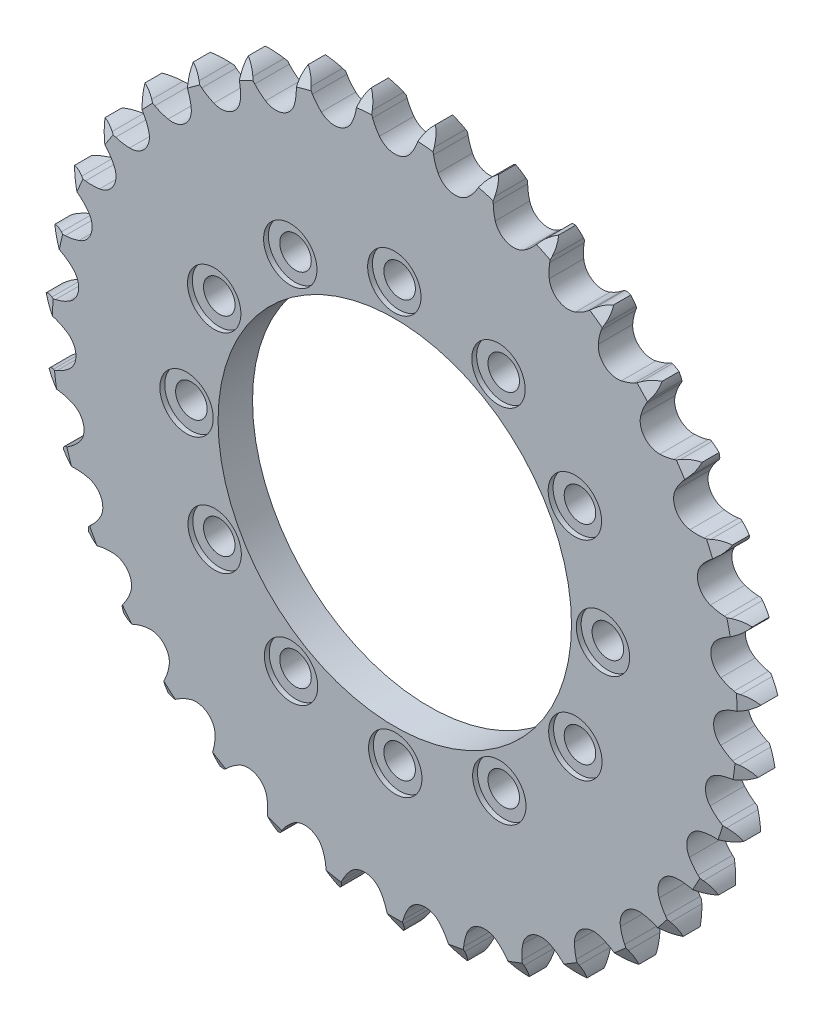
from build123d import *

# Parameters (mm, degrees)
EXTRUSION_DEPTH         = 7.2136
CIRPATTERN1_COUNT       = 12
CUT_EXTRUDE1_DEPTH      = 107.101930402
CUT_EXTRUDE1_DEPTH_BACK = 107.101930402
SKETCH8_R               = 37
CUT_EXTRUDE2_START      = 7.2136
SKETCH10_R              = 5.588
CUT_EXTRUDE2_DEPTH      = 1.016
CIRPATTERN2_COUNT       = 12


with BuildPart() as part:
    # Teeth Sketch → Extrusion (new body)
    with BuildSketch(Plane.XY):
        with BuildLine():
            ThreePointArc((6.71304247, 74.58801073), (5.721364967, 73.433815654), (5.028178681, 72.079163184))
            Line((5.028178681, 72.079163184), (4.640959349, 71.033174889))
            ThreePointArc((4.640959349, 71.033174889), (4.020032266, 69.686911282), (3.213588317, 68.442875791))
            ThreePointArc((3.213588317, 68.442875791), (0, 66.830622976), (-3.213588317, 68.442875791))
            ThreePointArc((-3.213588317, 68.442875791), (-4.020032266, 69.686911282), (-4.640959349, 71.033174889))
            Line((-4.640959349, 71.033174889), (-5.028178681, 72.079163184))
            ThreePointArc((-5.028178681, 72.079163184), (-5.721364967, 73.433815654), (-6.71304247, 74.58801073))
            ThreePointArc((-6.71304247, 74.58801073), (-7.482693818, 73.275293188), (-7.922857777, 71.81863735))
            Line((-7.922857777, 71.81863735), (-8.117085913, 70.720317836))
            ThreePointArc((-8.117085913, 70.720317836), (-8.487649793, 69.284818426), (-9.059002741, 67.91677897))
            ThreePointArc((-9.059002741, 67.91677897), (-11.933068516, 65.75662737), (-15.382892003, 66.769162268))
            ThreePointArc((-15.382892003, 66.769162268), (-16.39850718, 67.84920947), (-17.249840359, 69.062967255))
            Line((-17.249840359, 69.062967255), (-17.817605339, 70.023005406))
            ThreePointArc((-17.817605339, 70.023005406), (-18.741534375, 71.232114863), (-19.923364701, 72.190690694))
            ThreePointArc((-19.923364701, 72.190690694), (-20.446252667, 70.761642508), (-20.619247067, 69.249801418))
            Line((-20.619247067, 69.249801418), (-20.614241355, 68.134451579))
            ThreePointArc((-20.614241355, 68.134451579), (-20.722531804, 66.655854499), (-21.040429998, 65.207780992))
            ThreePointArc((-21.040429998, 65.207780992), (-23.482598391, 62.569159656), (-27.057776883, 62.949432932))
            ThreePointArc((-27.057776883, 62.949432932), (-28.249920581, 63.830778239), (-29.304297307, 64.873019029))
            Line((-29.304297307, 64.873019029), (-30.034359501, 65.716250619))
            ThreePointArc((-30.034359501, 65.716250619), (-31.159335447, 66.740955291), (-32.493333597, 67.473102461))
            ThreePointArc((-32.493333597, 67.473102461), (-32.752652133, 65.973654415), (-32.65291679, 64.455219891))
            Line((-32.65291679, 64.455219891), (-32.448838118, 63.358687986))
            ThreePointArc((-32.448838118, 63.358687986), (-32.291374592, 61.884516564), (-32.345600523, 60.402951279))
            ThreePointArc((-32.345600523, 60.402951279), (-34.277378233, 57.370667669), (-37.863002551, 57.106457027))
            ThreePointArc((-37.863002551, 57.106457027), (-39.19335829, 57.760773275), (-40.416890027, 58.597998593))
            Line((-40.416890027, 58.597998593), (-41.285784636, 59.297321467))
            ThreePointArc((-41.285784636, 59.297321467), (-42.57564984, 60.104686501), (-44.018940016, 60.586873197))
            ThreePointArc((-44.018940016, 60.586873197), (-44.006354409, 59.065218786), (-43.637094901, 57.588994562))
            Line((-43.637094901, 57.588994562), (-43.240502525, 56.54652403))
            ThreePointArc((-43.240502525, 56.54652403), (-42.822346032, 55.124159347), (-42.611156832, 53.656721012))
            ThreePointArc((-42.611156832, 53.656721012), (-43.970454934, 50.328235218), (-47.451280163, 49.428032606))
            ThreePointArc((-47.451280163, 49.428032606), (-48.877089215, 49.834289533), (-50.230450647, 50.439590267))
            Line((-50.230450647, 50.439590267), (-51.210250682, 50.972527612))
            ThreePointArc((-51.210250682, 50.972527612), (-52.623547816, 51.536603632), (-54.129741484, 51.753331977))
            ThreePointArc((-54.129741484, 51.753331977), (-53.845656247, 50.258378426), (-53.218740877, 48.871811564))
            Line((-53.218740877, 48.871811564), (-52.642381603, 47.916908265))
            ThreePointArc((-52.642381603, 47.916908265), (-51.976972035, 46.592066293), (-51.507155501, 45.185919584))
            ThreePointArc((-51.507155501, 45.185919584), (-52.250285035, 41.668211877), (-55.514434587, 40.160950547))
            ThreePointArc((-55.514434587, 40.160950547), (-56.989870277, 40.306090721), (-58.429563253, 40.660012009))
            Line((-58.429563253, 40.660012009), (-59.488777136, 41.009434779))
            ThreePointArc((-59.488777136, 41.009434779), (-60.980081666, 41.312091918), (-62.500768523, 41.256396085))
            ThreePointArc((-62.500768523, 41.256396085), (-61.954314388, 39.83619243), (-61.089892733, 38.58384833))
            Line((-61.089892733, 38.58384833), (-60.352291222, 37.747203643))
            ThreePointArc((-60.352291222, 37.747203643), (-59.461015391, 36.562465892), (-58.747671811, 35.26280552))
            ThreePointArc((-58.747671811, 35.26280552), (-58.850747983, 31.668937922), (-61.793309406, 29.603062493))
            ThreePointArc((-61.793309406, 29.603062493), (-63.270950016, 29.48242099), (-64.750701621, 29.573587509))
            Line((-64.750701621, 29.573587509), (-65.855285346, 29.72826497))
            ThreePointArc((-65.855285346, 29.72826497), (-67.376665517, 29.759775578), (-68.862969436, 29.433445677))
            ThreePointArc((-68.862969436, 29.433445677), (-68.071709889, 28.133638433), (-66.997565172, 27.055768464))
            Line((-66.997565172, 27.055768464), (-66.122428543, 26.364272836))
            ThreePointArc((-66.122428543, 26.364272836), (-65.033932787, 25.357717754), (-64.099989612, 24.206315873))
            ThreePointArc((-64.099989612, 24.206315873), (-63.559699469, 20.651798244), (-66.086096418, 18.093707653))
            ThreePointArc((-66.086096418, 18.093707653), (-67.518449363, 17.71116199), (-68.990699161, 17.536643574))
            Line((-68.990699161, 17.536643574), (-70.105150498, 17.491604264))
            ThreePointArc((-70.105150498, 17.491604264), (-71.6077079, 17.250955565), (-73.01185785, 16.664480107))
            ThreePointArc((-73.01185785, 16.664480107), (-72.001224624, 15.526846148), (-70.75188074, 14.658093938))
            Line((-70.75188074, 14.658093938), (-69.767336604, 14.133972608))
            ThreePointArc((-69.767336604, 14.133972608), (-68.516606073, 13.337951702), (-67.392081005, 12.371815317))
            ThreePointArc((-67.392081005, 12.371815317), (-66.225789916, 8.970892779), (-68.254821914, 6.002806162))
            ThreePointArc((-68.254821914, 6.002806162), (-69.595850193, 5.37065167), (-71.013278864, 4.936057485))
            Line((-71.013278864, 4.936057485), (-72.101778431, 4.692749005))
            ThreePointArc((-72.101778431, 4.692749005), (-73.537219633, 4.187675646), (-74.814085078, 3.359904435))
            ThreePointArc((-74.814085078, 3.359904435), (-73.616560757, 2.421008252), (-72.232172646, 1.789296212))
            Line((-72.232172646, 1.789296212), (-71.169865063, 1.449394871))
            ThreePointArc((-71.169865063, 1.449394871), (-69.797099265, 0.889492908), (-68.518135464, 0.139674437))
            ThreePointArc((-68.518135464, 0.139674437), (-66.763328985, -2.998344562), (-68.229781274, -6.281030459))
            ThreePointArc((-68.229781274, -6.281030459), (-69.436383134, -7.142475813), (-70.753433355, -7.823177553))
            Line((-70.753433355, -7.823177553), (-71.780995879, -8.256935068))
            ThreePointArc((-71.780995879, -8.256935068), (-73.10318462, -9.010199614), (-74.211726055, -10.05266133))
            ThreePointArc((-74.211726055, -10.05266133), (-72.865800055, -10.762642841), (-71.390863091, -11.137010967))
            Line((-71.390863091, -11.137010967), (-70.284935499, -11.281767609))
            ThreePointArc((-70.284935499, -11.281767609), (-68.834256257, -11.587554919), (-67.441960672, -12.096955695))
            ThreePointArc((-67.441960672, -12.096955695), (-65.155039727, -14.871212641), (-66.011779325, -18.362989592))
            ThreePointArc((-66.011779325, -18.362989592), (-67.045173588, -19.426038247), (-68.219514282, -20.330969227))
            Line((-68.219514282, -20.330969227), (-69.153113058, -20.941234454))
            ThreePointArc((-69.153113058, -20.941234454), (-70.319553103, -21.918479645), (-71.224141095, -23.142126289))
            ThreePointArc((-71.224141095, -23.142126289), (-69.773072586, -23.600373738), (-68.254992455, -23.705365449))
            Line((-68.254992455, -23.705365449), (-67.140990279, -23.650324796))
            ThreePointArc((-67.140990279, -23.650324796), (-65.659023615, -23.692169198), (-64.198145773, -23.944779717))
            ThreePointArc((-64.198145773, -23.944779717), (-61.452613883, -26.26610771), (-61.672104473, -29.854747131))
            ThreePointArc((-61.672104473, -29.854747131), (-62.499076998, -31.085231827), (-63.492963888, -32.185306822))
            Line((-63.492963888, -32.185306822), (-64.302592284, -32.952465334))
            ThreePointArc((-64.302592284, -32.952465334), (-65.275793291, -34.122281706), (-65.947353637, -35.487784268))
            ThreePointArc((-65.947353637, -35.487784268), (-64.437781154, -35.679569204), (-62.925350201, -35.511809981))
            Line((-62.925350201, -35.511809981), (-61.839078386, -35.258741085))
            ThreePointArc((-61.839078386, -35.258741085), (-60.373455931, -35.035297664), (-58.890949646, -35.022998817))
            ThreePointArc((-58.890949646, -35.022998817), (-55.775050465, -36.816788466), (-55.350237439, -40.386948533))
            ThreePointArc((-55.350237439, -40.386948533), (-55.94420865, -41.74532048), (-56.725697393, -43.005182174))
            Line((-56.725697393, -43.005182174), (-57.385333286, -43.904576866))
            ThreePointArc((-57.385333286, -43.904576866), (-58.134015774, -45.229365557), (-58.550963971, -46.69283566))
            ThreePointArc((-58.550963971, -46.69283566), (-57.031406416, -46.611993959), (-55.573235417, -46.176875721))
            Line((-55.573235417, -46.176875721), (-54.549607633, -45.733912424))
            ThreePointArc((-54.549607633, -45.733912424), (-53.147435697, -45.252362836), (-51.690949942, -44.975549918))
            ThreePointArc((-51.690949942, -44.975549918), (-48.304831033, -46.184147347), (-47.249368232, -49.621080178))
            ThreePointArc((-47.249368232, -49.621080178), (-47.591247404, -51.063680184), (-48.13522031, -52.442835586))
            Line((-48.13522031, -52.442835586), (-48.623662459, -53.445559171))
            ThreePointArc((-48.623662459, -53.445559171), (-49.123763156, -54.882740383), (-49.272698147, -56.397140896))
            ThreePointArc((-49.272698147, -56.397140896), (-47.79199535, -56.046270876), (-46.434951121, -55.357778681))
            Line((-46.434951121, -55.357778681), (-45.506867607, -54.739158188))
            ThreePointArc((-45.506867607, -54.739158188), (-44.21321315, -54.014979833), (-42.829560576, -53.482549839))
            ThreePointArc((-42.829560576, -53.482549839), (-39.282054587, -54.067109732), (-37.629865453, -57.260349478))
            ThreePointArc((-37.629865453, -57.260349478), (-37.708664308, -58.740811192), (-37.99763764, -60.194933112))
            Line((-37.99763764, -60.194933112), (-38.299187113, -61.26875723))
            ThreePointArc((-38.299187113, -61.26875723), (-38.534632372, -62.772138777), (-38.410767263, -64.288795619))
            ThreePointArc((-38.410767263, -64.288795619), (-37.016510231, -63.679174531), (-35.804209288, -62.759437086))
            Line((-35.804209288, -62.759437086), (-35.001499413, -61.985042368))
            ThreePointArc((-35.001499413, -61.985042368), (-33.857941554, -61.041510934), (-32.591593892, -60.270576602))
            ThreePointArc((-32.591593892, -60.270576602), (-28.996720584, -60.212310724), (-26.800907836, -63.059224032))
            ThreePointArc((-26.800907836, -63.059224032), (-26.614093715, -64.529964196), (-26.638779631, -66.012315959))
            Line((-26.638779631, -66.012315959), (-26.743744381, -67.12272702))
            ThreePointArc((-26.743744381, -67.12272702), (-26.706966797, -68.643988981), (-26.314282715, -70.114155555))
            ThreePointArc((-26.314282715, -70.114155555), (-25.051284015, -69.265377122), (-24.02269071, -68.143955544))
            Line((-24.02269071, -68.143955544), (-23.371154229, -67.238676285))
            ThreePointArc((-23.371154229, -67.238676285), (-22.414447858, -66.106117649), (-21.306106564, -65.121457443))
            ThreePointArc((-21.306106564, -65.121457443), (-17.779408124, -64.422238506), (-15.110546989, -66.83132324))
            ThreePointArc((-15.110546989, -66.83132324), (-14.664124252, -68.245071055), (-14.423729327, -69.708008656))
            Line((-14.423729327, -69.708008656), (-14.328735699, -70.819317134))
            ThreePointArc((-14.328735699, -70.819317134), (-14.020917334, -72.309564898), (-13.372035469, -73.68598884))
            ThreePointArc((-13.372035469, -73.68598884), (-12.280888919, -72.6253335), (-11.469063086, -71.338271201))
            Line((-11.469063086, -71.338271201), (-10.989640918, -70.331203822))
            ThreePointArc((-10.989640918, -70.331203822), (-10.250535365, -69.04601935), (-9.335823441, -67.879281059))
            ThreePointArc((-9.335823441, -67.879281059), (-5.990650857, -66.561582535), (-2.93452073, -68.455408731))
            ThreePointArc((-2.93452073, -68.455408731), (-2.242837769, -69.766725179), (-1.745088495, -71.163228599))
            Line((-1.745088495, -71.163228599), (-1.453189662, -72.239716126))
            ThreePointArc((-1.453189662, -72.239716126), (-0.884224052, -73.651051903), (0, -74.889493815))
            ThreePointArc((0, -74.889493815), (0.884224052, -73.651051903), (1.453189662, -72.239716126))
            Line((1.453189662, -72.239716126), (1.745088495, -71.163228599))
            ThreePointArc((1.745088495, -71.163228599), (2.242837769, -69.766725179), (2.93452073, -68.455408731))
            ThreePointArc((2.93452073, -68.455408731), (5.990650857, -66.561582535), (9.335823441, -67.879281059))
            ThreePointArc((9.335823441, -67.879281059), (10.250535365, -69.04601935), (10.989640918, -70.331203822))
            Line((10.989640918, -70.331203822), (11.469063086, -71.338271201))
            ThreePointArc((11.469063086, -71.338271201), (12.280888919, -72.6253335), (13.372035469, -73.68598884))
            ThreePointArc((13.372035469, -73.68598884), (14.020917334, -72.309564898), (14.328735699, -70.819317134))
            Line((14.328735699, -70.819317134), (14.423729327, -69.708008656))
            ThreePointArc((14.423729327, -69.708008656), (14.664124252, -68.245071055), (15.110546989, -66.83132324))
            ThreePointArc((15.110546989, -66.83132324), (17.779408124, -64.422238506), (21.306106564, -65.121457443))
            ThreePointArc((21.306106564, -65.121457443), (22.414447858, -66.106117649), (23.371154229, -67.238676285))
            Line((23.371154229, -67.238676285), (24.02269071, -68.143955544))
            ThreePointArc((24.02269071, -68.143955544), (25.051284015, -69.265377122), (26.314282715, -70.114155555))
            ThreePointArc((26.314282715, -70.114155555), (26.706966797, -68.643988981), (26.743744381, -67.12272702))
            Line((26.743744381, -67.12272702), (26.638779631, -66.012315959))
            ThreePointArc((26.638779631, -66.012315959), (26.614093715, -64.529964196), (26.800907836, -63.059224032))
            ThreePointArc((26.800907836, -63.059224032), (28.996720584, -60.212310724), (32.591593892, -60.270576602))
            ThreePointArc((32.591593892, -60.270576602), (33.857941554, -61.041510934), (35.001499413, -61.985042368))
            Line((35.001499413, -61.985042368), (35.804209288, -62.759437086))
            ThreePointArc((35.804209288, -62.759437086), (37.016510231, -63.679174531), (38.410767263, -64.288795619))
            ThreePointArc((38.410767263, -64.288795619), (38.534632372, -62.772138777), (38.299187113, -61.26875723))
            Line((38.299187113, -61.26875723), (37.99763764, -60.194933112))
            ThreePointArc((37.99763764, -60.194933112), (37.708664308, -58.740811192), (37.629865453, -57.260349478))
            ThreePointArc((37.629865453, -57.260349478), (39.282054587, -54.067109732), (42.829560576, -53.482549839))
            ThreePointArc((42.829560576, -53.482549839), (44.21321315, -54.014979833), (45.506867607, -54.739158188))
            Line((45.506867607, -54.739158188), (46.434951121, -55.357778681))
            ThreePointArc((46.434951121, -55.357778681), (47.79199535, -56.046270876), (49.272698147, -56.397140896))
            ThreePointArc((49.272698147, -56.397140896), (49.123763156, -54.882740383), (48.623662459, -53.445559171))
            Line((48.623662459, -53.445559171), (48.13522031, -52.442835586))
            ThreePointArc((48.13522031, -52.442835586), (47.591247404, -51.063680184), (47.249368232, -49.621080178))
            ThreePointArc((47.249368232, -49.621080178), (48.304831033, -46.184147347), (51.690949942, -44.975549918))
            ThreePointArc((51.690949942, -44.975549918), (53.147435697, -45.252362836), (54.549607633, -45.733912424))
            Line((54.549607633, -45.733912424), (55.573235417, -46.176875721))
            ThreePointArc((55.573235417, -46.176875721), (57.031406416, -46.611993959), (58.550963971, -46.69283566))
            ThreePointArc((58.550963971, -46.69283566), (58.134015774, -45.229365557), (57.385333286, -43.904576866))
            Line((57.385333286, -43.904576866), (56.725697393, -43.005182174))
            ThreePointArc((56.725697393, -43.005182174), (55.94420865, -41.74532048), (55.350237439, -40.386948533))
            ThreePointArc((55.350237439, -40.386948533), (55.775050465, -36.816788466), (58.890949646, -35.022998817))
            ThreePointArc((58.890949646, -35.022998817), (60.373455931, -35.035297664), (61.839078386, -35.258741085))
            Line((61.839078386, -35.258741085), (62.925350201, -35.511809981))
            ThreePointArc((62.925350201, -35.511809981), (64.437781154, -35.679569204), (65.947353637, -35.487784268))
            ThreePointArc((65.947353637, -35.487784268), (65.275793291, -34.122281706), (64.302592284, -32.952465334))
            Line((64.302592284, -32.952465334), (63.492963888, -32.185306822))
            ThreePointArc((63.492963888, -32.185306822), (62.499076998, -31.085231827), (61.672104473, -29.854747131))
            ThreePointArc((61.672104473, -29.854747131), (61.452613883, -26.26610771), (64.198145773, -23.944779717))
            ThreePointArc((64.198145773, -23.944779717), (65.659023615, -23.692169198), (67.140990279, -23.650324796))
            Line((67.140990279, -23.650324796), (68.254992455, -23.705365449))
            ThreePointArc((68.254992455, -23.705365449), (69.773072586, -23.600373738), (71.224141095, -23.142126289))
            ThreePointArc((71.224141095, -23.142126289), (70.319553103, -21.918479645), (69.153113058, -20.941234454))
            Line((69.153113058, -20.941234454), (68.219514282, -20.330969227))
            ThreePointArc((68.219514282, -20.330969227), (67.045173588, -19.426038247), (66.011779325, -18.362989592))
            ThreePointArc((66.011779325, -18.362989592), (65.155039727, -14.871212641), (67.441960672, -12.096955695))
            ThreePointArc((67.441960672, -12.096955695), (68.834256257, -11.587554919), (70.284935499, -11.281767609))
            Line((70.284935499, -11.281767609), (71.390863091, -11.137010967))
            ThreePointArc((71.390863091, -11.137010967), (72.865800055, -10.762642841), (74.211726055, -10.05266133))
            ThreePointArc((74.211726055, -10.05266133), (73.10318462, -9.010199614), (71.780995879, -8.256935068))
            Line((71.780995879, -8.256935068), (70.753433355, -7.823177553))
            ThreePointArc((70.753433355, -7.823177553), (69.436383134, -7.142475813), (68.229781274, -6.281030459))
            ThreePointArc((68.229781274, -6.281030459), (66.763328985, -2.998344562), (68.518135464, 0.139674437))
            ThreePointArc((68.518135464, 0.139674437), (69.797099265, 0.889492908), (71.169865063, 1.449394871))
            Line((71.169865063, 1.449394871), (72.232172646, 1.789296212))
            ThreePointArc((72.232172646, 1.789296212), (73.616560757, 2.421008252), (74.814085078, 3.359904435))
            ThreePointArc((74.814085078, 3.359904435), (73.537219633, 4.187675646), (72.101778431, 4.692749005))
            Line((72.101778431, 4.692749005), (71.013278864, 4.936057485))
            ThreePointArc((71.013278864, 4.936057485), (69.595850193, 5.37065167), (68.254821914, 6.002806162))
            ThreePointArc((68.254821914, 6.002806162), (66.225789916, 8.970892779), (67.392081005, 12.371815317))
            ThreePointArc((67.392081005, 12.371815317), (68.516606073, 13.337951702), (69.767336604, 14.133972608))
            Line((69.767336604, 14.133972608), (70.75188074, 14.658093938))
            ThreePointArc((70.75188074, 14.658093938), (72.001224624, 15.526846148), (73.01185785, 16.664480107))
            ThreePointArc((73.01185785, 16.664480107), (71.6077079, 17.250955565), (70.105150498, 17.491604264))
            Line((70.105150498, 17.491604264), (68.990699161, 17.536643574))
            ThreePointArc((68.990699161, 17.536643574), (67.518449363, 17.71116199), (66.086096418, 18.093707653))
            ThreePointArc((66.086096418, 18.093707653), (63.559699469, 20.651798244), (64.099989612, 24.206315873))
            ThreePointArc((64.099989612, 24.206315873), (65.033932787, 25.357717754), (66.122428543, 26.364272836))
            Line((66.122428543, 26.364272836), (66.997565172, 27.055768464))
            ThreePointArc((66.997565172, 27.055768464), (68.071709889, 28.133638433), (68.862969436, 29.433445677))
            ThreePointArc((68.862969436, 29.433445677), (67.376665517, 29.759775578), (65.855285346, 29.72826497))
            Line((65.855285346, 29.72826497), (64.750701621, 29.573587509))
            ThreePointArc((64.750701621, 29.573587509), (63.270950016, 29.48242099), (61.793309406, 29.603062493))
            ThreePointArc((61.793309406, 29.603062493), (58.850747983, 31.668937922), (58.747671811, 35.26280552))
            ThreePointArc((58.747671811, 35.26280552), (59.461015391, 36.562465892), (60.352291222, 37.747203643))
            Line((60.352291222, 37.747203643), (61.089892733, 38.58384833))
            ThreePointArc((61.089892733, 38.58384833), (61.954314388, 39.83619243), (62.500768523, 41.256396085))
            ThreePointArc((62.500768523, 41.256396085), (60.980081666, 41.312091918), (59.488777136, 41.009434779))
            Line((59.488777136, 41.009434779), (58.429563253, 40.660012009))
            ThreePointArc((58.429563253, 40.660012009), (56.989870277, 40.306090721), (55.514434587, 40.160950547))
            ThreePointArc((55.514434587, 40.160950547), (52.250285035, 41.668211877), (51.507155501, 45.185919584))
            ThreePointArc((51.507155501, 45.185919584), (51.976972035, 46.592066293), (52.642381603, 47.916908265))
            Line((52.642381603, 47.916908265), (53.218740877, 48.871811564))
            ThreePointArc((53.218740877, 48.871811564), (53.845656247, 50.258378426), (54.129741484, 51.753331977))
            ThreePointArc((54.129741484, 51.753331977), (52.623547816, 51.536603632), (51.210250682, 50.972527612))
            Line((51.210250682, 50.972527612), (50.230450647, 50.439590267))
            ThreePointArc((50.230450647, 50.439590267), (48.877089215, 49.834289533), (47.451280163, 49.428032606))
            ThreePointArc((47.451280163, 49.428032606), (43.970454934, 50.328235218), (42.611156832, 53.656721012))
            ThreePointArc((42.611156832, 53.656721012), (42.822346032, 55.124159347), (43.240502525, 56.54652403))
            Line((43.240502525, 56.54652403), (43.637094901, 57.588994562))
            ThreePointArc((43.637094901, 57.588994562), (44.006354409, 59.065218786), (44.018940016, 60.586873197))
            ThreePointArc((44.018940016, 60.586873197), (42.57564984, 60.104686501), (41.285784636, 59.297321467))
            Line((41.285784636, 59.297321467), (40.416890027, 58.597998593))
            ThreePointArc((40.416890027, 58.597998593), (39.19335829, 57.760773275), (37.863002551, 57.106457027))
            ThreePointArc((37.863002551, 57.106457027), (34.277378233, 57.370667669), (32.345600523, 60.402951279))
            ThreePointArc((32.345600523, 60.402951279), (32.291374592, 61.884516564), (32.448838118, 63.358687986))
            Line((32.448838118, 63.358687986), (32.65291679, 64.455219891))
            ThreePointArc((32.65291679, 64.455219891), (32.752652133, 65.973654415), (32.493333597, 67.473102461))
            ThreePointArc((32.493333597, 67.473102461), (31.159335447, 66.740955291), (30.034359501, 65.716250619))
            Line((30.034359501, 65.716250619), (29.304297307, 64.873019029))
            ThreePointArc((29.304297307, 64.873019029), (28.249920581, 63.830778239), (27.057776883, 62.949432932))
            ThreePointArc((27.057776883, 62.949432932), (23.482598391, 62.569159656), (21.040429998, 65.207780992))
            ThreePointArc((21.040429998, 65.207780992), (20.722531804, 66.655854499), (20.614241355, 68.134451579))
            Line((20.614241355, 68.134451579), (20.619247067, 69.249801418))
            ThreePointArc((20.619247067, 69.249801418), (20.446252667, 70.761642508), (19.923364701, 72.190690694))
            ThreePointArc((19.923364701, 72.190690694), (18.741534375, 71.232114863), (17.817605339, 70.023005406))
            Line((17.817605339, 70.023005406), (17.249840359, 69.062967255))
            ThreePointArc((17.249840359, 69.062967255), (16.39850718, 67.84920947), (15.382892003, 66.769162268))
            ThreePointArc((15.382892003, 66.769162268), (11.933068516, 65.75662737), (9.059002741, 67.91677897))
            ThreePointArc((9.059002741, 67.91677897), (8.487649793, 69.284818426), (8.117085913, 70.720317836))
            Line((8.117085913, 70.720317836), (7.922857777, 71.81863735))
            ThreePointArc((7.922857777, 71.81863735), (7.482693818, 73.275293188), (6.71304247, 74.58801073))
        make_face()
    extrude(amount=EXTRUSION_DEPTH)

    # Sketch7 → M6 Clearance Hole1 (revolve, cut)
    with BuildSketch(Plane(origin=(0, 43.500000122, 0), x_dir=(0, 1, 0), z_dir=(1, 0, 0))):
        Polygon((0, 0), (0, 19.254840043), (3.3, 17.272), (3.3, 0), align=None)
    m6_clearance_hole1 = revolve(axis=Axis((0, 43.500000122, -6.35), (0, 0, 1)), mode=Mode.SUBTRACT)

    # CirPattern1: M6 Clearance Hole1 ×12 about axis
    cirpattern1_axis = Axis((0, -0.098226523, 0), (0, 0, 1))
    for i in range(1, CIRPATTERN1_COUNT):
        add(m6_clearance_hole1.rotate(cirpattern1_axis, i * 360 / CIRPATTERN1_COUNT), mode=Mode.SUBTRACT)

    # Sketch8 → Cut-Extrude1 (cut, two sides: drawn at the far end of the back side and taken through both)
    with BuildSketch(Plane(origin=(0, 0, 0), x_dir=(-1, 0, 0), z_dir=(0, 0, -1)).offset(-CUT_EXTRUDE1_DEPTH_BACK)):
        Circle(SKETCH8_R)
    extrude(amount=CUT_EXTRUDE1_DEPTH + CUT_EXTRUDE1_DEPTH_BACK, mode=Mode.SUBTRACT)

    # Sketch5 → Cut-Revolve1 (revolve, cut)
    with BuildSketch(Plane(origin=(0, 0, 0), x_dir=(0, 0, -1), z_dir=(1, 0, 0))):
        Polygon((-7.2136, -71.695911683), (-7.2136, -74.889493815), (-5.3848, -74.889493815), align=None)
    cut_revolve1 = revolve(axis=Axis((0, 0, 7.2136), (0, 0, -1)), mode=Mode.SUBTRACT)

    # Mirror1: Cut-Revolve1 across plane
    add(cut_revolve1.mirror(Plane.XY.offset(3.6068)), mode=Mode.SUBTRACT)

    # Sketch10 → Cut-Extrude2 (cut)
    with BuildSketch(Plane.XY.offset(CUT_EXTRUDE2_START)):
        with Locations((-43.598226645, -0.098226523)):
            Circle(SKETCH10_R)
    cut_extrude2 = extrude(amount=-CUT_EXTRUDE2_DEPTH, mode=Mode.SUBTRACT)

    # CirPattern2: Cut-Extrude2 ×12 about axis
    cirpattern2_axis = Axis((0, 0, 0), (0, 0, 1))
    for i in range(1, CIRPATTERN2_COUNT):
        add(cut_extrude2.rotate(cirpattern2_axis, i * 360 / CIRPATTERN2_COUNT), mode=Mode.SUBTRACT)


solid = part.part
